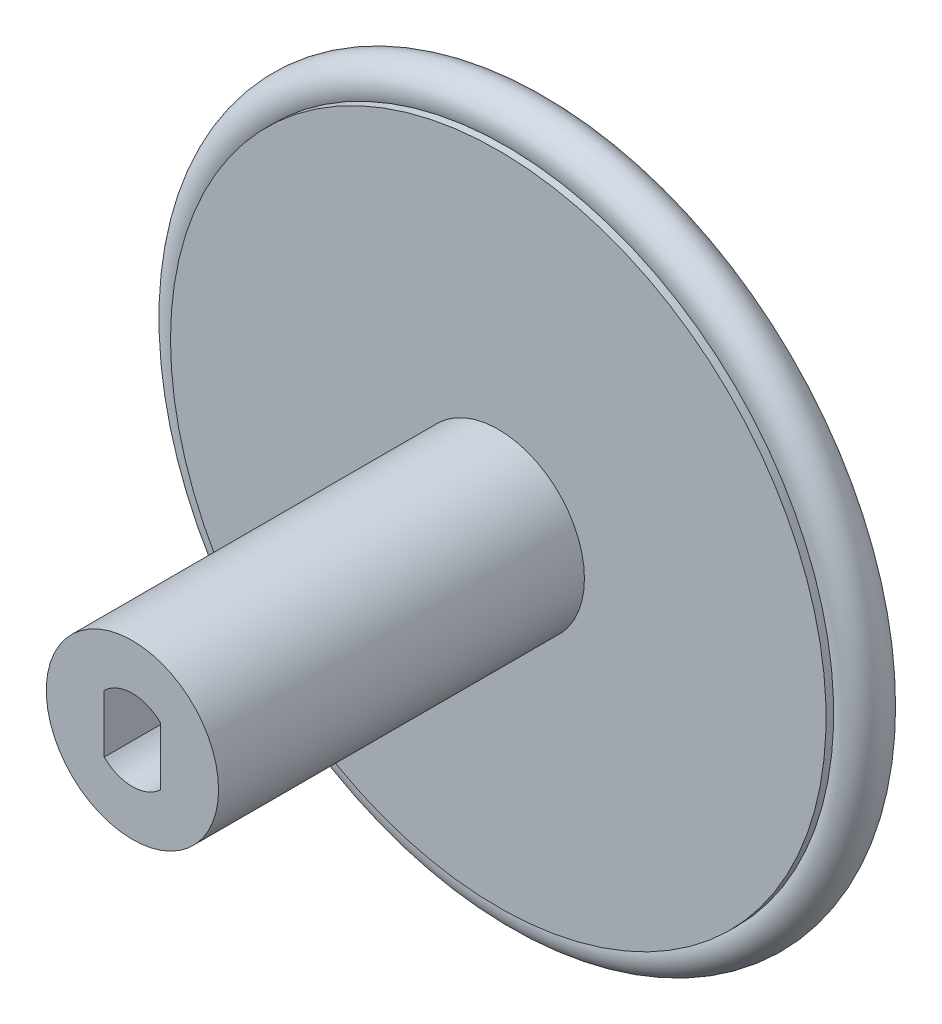
from build123d import *

# Parameters (mm, degrees)
CROQUIS3_R              = 5.65
SALIENTE_EXTRUIR2_DEPTH = 24
SALIENTE_EXTRUIR3_REACH = 48.199
SALIENTE_EXTRUIR3_START = -5
CROQUIS5_R              = 1.5


with BuildPart() as part:
    # Croquis1 → Revolución1 (revolve)
    with BuildSketch(Plane(origin=(0, 0, 0), x_dir=(0, 0, -1), z_dir=(1, 0, 0)), mode=Mode.PRIVATE) as revoluci_n1_sk:
        Polygon((-1.9, 0), (-1.9, 21.5), (-1.4, 21.5), (-0.5, 19.000153831), (0.5, 19.000153831), (1.4, 21.5), (1.9, 21.5), (1.9, 0), align=None)
    revolve(revoluci_n1_sk.sketch.rotate(Axis((0, 0, -6.227056579), (0, 0, 1)), 90), axis=Axis((0, 0, -6.227056579), (0, 0, 1)))

    # Croquis3 → Saliente-Extruir2 (add)
    with BuildSketch(Plane.XY.offset(1.9)):
        Circle(CROQUIS3_R)
        with BuildLine():
            Line((-1.85, 1.897366596), (-1.85, -1.897366596))
            ThreePointArc((-1.85, -1.897366596), (0, -2.65), (1.85, -1.897366596))
            Line((1.85, -1.897366596), (1.85, 1.897366596))
            ThreePointArc((1.85, 1.897366596), (0, 2.65), (-1.85, 1.897366596))
        make_face(mode=Mode.SUBTRACT)
    extrude(amount=SALIENTE_EXTRUIR2_DEPTH)

    # Croquis4 → Saliente-Extruir3 (add, up to next)
    with BuildSketch(Plane.XY.offset(25.9).offset(SALIENTE_EXTRUIR3_START), mode=Mode.PRIVATE) as saliente_extruir3_sk1:
        with BuildLine():
            Line((-1.85, 1.897366596), (-1.85, -1.897366596))
            ThreePointArc((-1.85, -1.897366596), (0, -2.65), (1.85, -1.897366596))
            Line((1.85, -1.897366596), (1.85, 1.897366596))
            ThreePointArc((1.85, 1.897366596), (0, 2.65), (-1.85, 1.897366596))
        make_face()
    saliente_extruir3_tool1 = extrude(saliente_extruir3_sk1.sketch, amount=-SALIENTE_EXTRUIR3_REACH, mode=Mode.PRIVATE) - part.part
    add(saliente_extruir3_tool1.solids().sort_by_distance((0, 0, 20.9))[0])


with BuildPart() as body_2:
    # Croquis5 → Revolución2 (revolve)
    with BuildSketch(Plane(origin=(0, 0, 0), x_dir=(0, 0, -1), z_dir=(1, 0, 0)), mode=Mode.PRIVATE) as revoluci_n2_sk:
        with Locations((0, 22.039552594)):
            Circle(CROQUIS5_R)
    revolve(revoluci_n2_sk.sketch.rotate(Axis((0, 0, 9.093206655), (0, 0, -1)), 90), axis=Axis((0, 0, 9.093206655), (0, 0, -1)))


solid = Compound([part.part, body_2.part])
